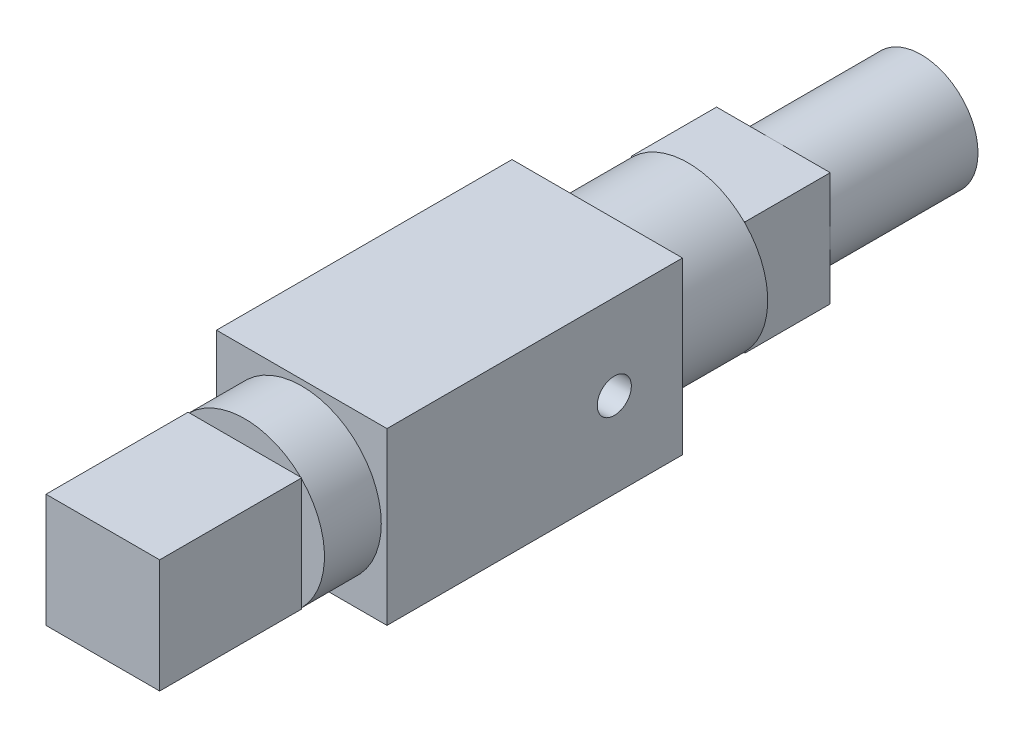
from build123d import *

# Parameters (mm, degrees)
SCHIZZO1_R                   = 5
ESTRUSIONE_ESTRUSIONE1_DEPTH = 13
SCHIZZO2_W                   = 10
SCHIZZO2_H                   = 10
ESTRUSIONE_ESTRUSIONE2_DEPTH = 7.5
SCHIZZO3_R                   = 7
ESTRUSIONE_ESTRUSIONE3_DEPTH = 8
SCHIZZO4_W                   = 15
SCHIZZO4_H                   = 15
ESTRUSIONE_ESTRUSIONE4_DEPTH = 26
SCHIZZO5_R                   = 7
ESTRUSIONE_ESTRUSIONE5_DEPTH = 5
SCHIZZO6_W                   = 10
SCHIZZO6_H                   = 10
ESTRUSIONE_ESTRUSIONE6_DEPTH = 12.5
CUPOLA1_FACE_RADIUS          = 5
CUPOLA1_HEIGHT               = 1.3
SCHIZZO7_R                   = 1.5
TAGLIO_ESTRUSIONE1_DEPTH     = 74.927329182


with BuildPart() as part:
    # Schizzo1 → Estrusione-Estrusione1 (new body)
    with BuildSketch(Plane.XY):
        with Locations(Location((0, 0, 0), (0, 0, 180))):
            Circle(SCHIZZO1_R)
    extrude(amount=ESTRUSIONE_ESTRUSIONE1_DEPTH)

    # Schizzo2 → Estrusione-Estrusione2 (add)
    with BuildSketch(Plane.XY.offset(13)):
        Rectangle(SCHIZZO2_W, SCHIZZO2_H)
    extrude(amount=ESTRUSIONE_ESTRUSIONE2_DEPTH)

    # Schizzo3 → Estrusione-Estrusione3 (add)
    with BuildSketch(Plane.XY.offset(20.5)):
        with Locations(Location((0, 0, 0), (0, 0, 135.584691403))):
            Circle(SCHIZZO3_R)
    extrude(amount=ESTRUSIONE_ESTRUSIONE3_DEPTH)

    # Schizzo4 → Estrusione-Estrusione4 (add)
    with BuildSketch(Plane.XY.offset(28.5)):
        Rectangle(SCHIZZO4_W, SCHIZZO4_H)
    extrude(amount=ESTRUSIONE_ESTRUSIONE4_DEPTH)

    # Schizzo5 → Estrusione-Estrusione5 (add)
    with BuildSketch(Plane.XY.offset(54.5)):
        with Locations(Location((0, 0, 0), (0, 0, 135.584691403))):
            Circle(SCHIZZO5_R)
    extrude(amount=ESTRUSIONE_ESTRUSIONE5_DEPTH)

    # Schizzo6 → Estrusione-Estrusione6 (add)
    with BuildSketch(Plane.XY.offset(59.5)):
        Rectangle(SCHIZZO6_W, SCHIZZO6_H)
    extrude(amount=ESTRUSIONE_ESTRUSIONE6_DEPTH)

    # Cupola1: a dome of height H over a round flat face of radius A is a cap of a sphere of radius (A * A + H * H) / (2 * H)
    cupola1_r = (CUPOLA1_FACE_RADIUS * CUPOLA1_FACE_RADIUS + CUPOLA1_HEIGHT * CUPOLA1_HEIGHT) / (2 * CUPOLA1_HEIGHT)
    cupola1_base = Plane((0, 0, 0), z_dir=(0, 0, -1))
    with Locations(cupola1_base.offset(CUPOLA1_HEIGHT - cupola1_r)):
        cupola1_ball = Sphere(cupola1_r, mode=Mode.PRIVATE)
    add(split(cupola1_ball, bisect_by=cupola1_base, keep=Keep.TOP, mode=Mode.PRIVATE))

    # Schizzo7 → Taglio-Estrusione1 (cut, through all)
    with BuildSketch(Plane.ZY.offset(7.5)):
        with Locations((34.5, 0)):
            Circle(SCHIZZO7_R)
    extrude(amount=-TAGLIO_ESTRUSIONE1_DEPTH, mode=Mode.SUBTRACT)


solid = part.part
